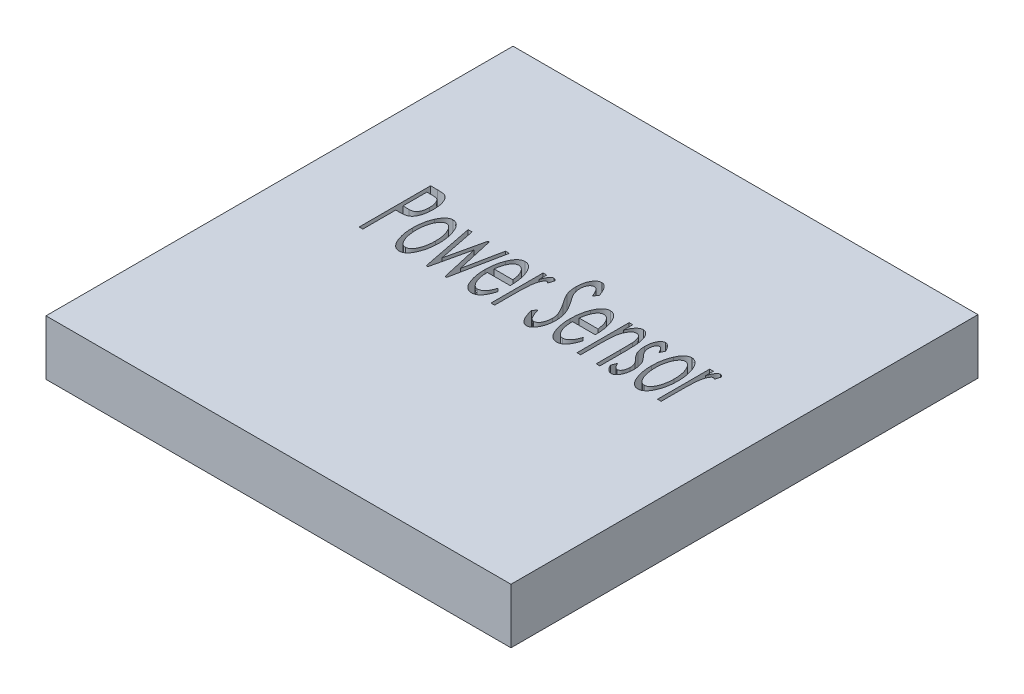
from build123d import *

# Parameters (mm, degrees)
SKETCH1_W           = 22.8
SKETCH1_H           = 22.9
BOSS_EXTRUDE1_DEPTH = 2.7
CUT_EXTRUDE1_DEPTH  = 1


with BuildPart() as part:
    # Sketch1 → Boss-Extrude1 (new body)
    with BuildSketch(Plane(origin=(0, 0, 0), x_dir=(1, 0, 0), z_dir=(0, 1, 0))):
        with Locations((-11.4, 11.45)):
            Rectangle(SKETCH1_W, SKETCH1_H)
    extrude(amount=BOSS_EXTRUDE1_DEPTH)

    # Sketch2 → Cut-Extrude1 (cut)
    # profile 1 of 11: a face of its own
    with BuildSketch(Plane(origin=(0, 2.7, 0), x_dir=(1, 0, 0), z_dir=(0, 1, 0))):
        with BuildLine():
            Line((-18.893589744, 14.95), (-18.550040064, 14.95))
            add(Edge.make_bspline(
                [(-18.550040064, 14.95), (-18.526431527, 14.949949806), (-18.481298921, 14.949853851), (-18.416547049, 14.946826514), (-18.357613941, 14.942774139), (-18.304758109, 14.937266147), (-18.257824867, 14.93060332), (-18.217206038, 14.921224082), (-18.181822555, 14.911563521), (-18.16128536, 14.901884762), (-18.151802885, 14.897415865)],
                knots=[0, 0, 0, 0, 1.400665648, 2.677662257, 3.84548299, 4.905220341, 5.830907861, 6.655166745, 7.379060902, 8, 8, 8, 8], degree=3))
            add(Edge.make_bspline(
                [(-18.151802885, 14.897415865), (-18.139460053, 14.890711185), (-18.114493334, 14.877149154), (-18.079994867, 14.850742842), (-18.047687511, 14.819202442), (-18.015883373, 14.783960042), (-17.987473005, 14.742308818), (-17.959157809, 14.697065536), (-17.933351138, 14.646313977), (-17.901136451, 14.570689323), (-17.865572943, 14.466198791), (-17.836918418, 14.327568979), (-17.819357569, 14.174313602), (-17.817588967, 14.067105438), (-17.816666667, 14.011197917)],
                knots=[0, 0, 0, 0, 0.510523556, 1.032672098, 1.573997133, 2.152394369, 2.75641807, 3.405457915, 4.093862063, 4.825255744, 6.395758809, 8.100381875, 9.966405038, 12, 12, 12, 12], degree=3))
            add(Edge.make_bspline(
                [(-17.816666667, 14.011197917), (-17.817660498, 13.955066338), (-17.819562009, 13.847668999), (-17.836102939, 13.694124339), (-17.864467958, 13.555954652), (-17.898041133, 13.451426168), (-17.930736128, 13.376627427), (-17.95636144, 13.326041555), (-17.984633679, 13.280605667), (-18.013798554, 13.238892928), (-18.047254515, 13.203640172), (-18.081397154, 13.171566811), (-18.118206152, 13.14460187), (-18.14439601, 13.130089144), (-18.157411859, 13.122876603)],
                knots=[0, 0, 0, 0, 2.028323131, 3.880819216, 5.572197309, 7.118765787, 7.837476376, 8.521238193, 9.165901164, 9.770766602, 10.3565773, 10.918517971, 11.462524529, 12, 12, 12, 12], degree=3))
            add(Edge.make_bspline(
                [(-18.157411859, 13.122876603), (-18.168085975, 13.118235109), (-18.191106628, 13.108224891), (-18.229895169, 13.096622743), (-18.274908942, 13.086917077), (-18.326253836, 13.079538892), (-18.383782964, 13.073299286), (-18.447602854, 13.068339126), (-18.517763904, 13.065599871), (-18.566630931, 13.06545838), (-18.592107372, 13.065384615)],
                knots=[0, 0, 0, 0, 0.632475031, 1.364046288, 2.196596121, 3.134759838, 4.183081226, 5.342934046, 6.614759579, 8, 8, 8, 8], degree=3))
            Line((-18.592107372, 13.065384615), (-18.714102564, 13.065384615))
            Line((-18.714102564, 13.065384615), (-18.714102564, 11.45))
            Line((-18.714102564, 11.45), (-18.893589744, 11.45))
            Line((-18.893589744, 11.45), (-18.893589744, 14.95))
        make_face()
        with BuildLine():
            Line((-18.714102564, 14.591025641), (-18.714102564, 13.424358974))
            Line((-18.714102564, 13.424358974), (-18.425941506, 13.416646635))
            add(Edge.make_bspline(
                [(-18.425941506, 13.416646635), (-18.398539785, 13.417355784), (-18.347643508, 13.418672967), (-18.277100534, 13.430581531), (-18.217624809, 13.449280483), (-18.168818641, 13.47865232), (-18.129322603, 13.517831121), (-18.094486916, 13.56549478), (-18.065759055, 13.623687678), (-18.040663013, 13.690150233), (-18.021015312, 13.763496171), (-18.005970113, 13.841945554), (-17.997765876, 13.924549203), (-17.996697755, 13.981032999), (-17.996153846, 14.009795673)],
                knots=[0, 0, 0, 0, 1.171517057, 2.175989491, 3.051930863, 3.823668683, 4.587461645, 5.417507434, 6.338794821, 7.354700361, 8.453635278, 9.583305836, 10.769371189, 12, 12, 12, 12], degree=3))
            add(Edge.make_bspline(
                [(-17.996153846, 14.009795673), (-17.996700529, 14.037857857), (-17.997778196, 14.093176443), (-18.006031699, 14.174371421), (-18.021002807, 14.251896676), (-18.040744492, 14.32475123), (-18.065674325, 14.390344668), (-18.093240996, 14.447855582), (-18.126096256, 14.494158246), (-18.163436235, 14.532045688), (-18.210093288, 14.559698959), (-18.267561258, 14.577741513), (-18.336393792, 14.589893016), (-18.386381435, 14.590628998), (-18.413321314, 14.591025641)],
                knots=[0, 0, 0, 0, 1.228640533, 2.422001712, 3.567959277, 4.682650608, 5.722243594, 6.637509838, 7.466634469, 8.197487603, 8.950360157, 9.814366158, 10.822094659, 12, 12, 12, 12], degree=3))
            Line((-18.413321314, 14.591025641), (-18.714102564, 14.591025641))
        make_face(mode=Mode.SUBTRACT)
    # profile 2 of 11: a face of its own
    with BuildSketch(Plane(origin=(0, 2.7, 0), x_dir=(1, 0, 0), z_dir=(0, 1, 0))):
        with BuildLine():
            add(Edge.make_bspline(
                [(-16.89609375, 14.052564103), (-16.872330992, 14.051499828), (-16.825066913, 14.049382989), (-16.756634199, 14.027596226), (-16.691797278, 13.993737997), (-16.629275181, 13.947678243), (-16.571360683, 13.887040065), (-16.516517801, 13.813862791), (-16.464507341, 13.72783043), (-16.434414702, 13.664440613), (-16.418629808, 13.631189904)],
                knots=[0, 0, 0, 0, 0.843577701, 1.677874383, 2.529941952, 3.44009667, 4.428447994, 5.503311921, 6.690378774, 8, 8, 8, 8], degree=3))
            add(Edge.make_bspline(
                [(-16.418629808, 13.631189904), (-16.404619617, 13.598649272), (-16.376254204, 13.532766629), (-16.341783712, 13.429700017), (-16.312313345, 13.322464577), (-16.287289102, 13.210975472), (-16.270099057, 13.094633231), (-16.255205489, 12.974333522), (-16.247992358, 12.849527953), (-16.246773081, 12.764843586), (-16.246153846, 12.721834936)],
                knots=[0, 0, 0, 0, 0.911590579, 1.845630971, 2.79426017, 3.773633235, 4.784390523, 5.820063118, 6.892875455, 8, 8, 8, 8], degree=3))
            add(Edge.make_bspline(
                [(-16.246153846, 12.721834936), (-16.246701312, 12.678588436), (-16.247779554, 12.593413901), (-16.256036605, 12.467694008), (-16.271303016, 12.346160502), (-16.290072481, 12.228435201), (-16.316829333, 12.115200316), (-16.346841974, 12.005730583), (-16.384629236, 11.900842016), (-16.426586903, 11.801177105), (-16.47244727, 11.70917736), (-16.523209409, 11.628832524), (-16.576151498, 11.559855138), (-16.633497579, 11.503657449), (-16.694015751, 11.459436135), (-16.758195027, 11.427803973), (-16.826074937, 11.408824076), (-16.872605163, 11.406368026), (-16.89609375, 11.405128205)],
                knots=[0, 0, 0, 0, 1.301298947, 2.562924903, 3.788461415, 4.986201962, 6.14793309, 7.287790237, 8.39993342, 9.49971249, 10.540722194, 11.488924044, 12.355509222, 13.151197152, 13.89676473, 14.601269901, 15.293917145, 16, 16, 16, 16], degree=3))
            add(Edge.make_bspline(
                [(-16.89609375, 11.405128205), (-16.919576348, 11.406392688), (-16.966320374, 11.408909744), (-17.034498113, 11.42765886), (-17.098889663, 11.459427395), (-17.159444074, 11.503848069), (-17.217424047, 11.559804751), (-17.271131147, 11.628617161), (-17.321821637, 11.709200257), (-17.367638038, 11.801194182), (-17.409937248, 11.900670993), (-17.446243889, 12.006030857), (-17.478057311, 12.114929737), (-17.502892757, 12.228655422), (-17.523574492, 12.34599898), (-17.537197916, 12.467770713), (-17.545903867, 12.59340098), (-17.546919978, 12.678584084), (-17.547435897, 12.721834936)],
                knots=[0, 0, 0, 0, 0.705440217, 1.4042363, 2.108100269, 2.852989273, 3.652997896, 4.523145192, 5.47048404, 6.510546275, 7.609324387, 8.718120464, 9.858867499, 11.017987859, 12.215813406, 13.439407729, 14.699885423, 16, 16, 16, 16], degree=3))
            add(Edge.make_bspline(
                [(-17.547435897, 12.721834936), (-17.546821384, 12.764611226), (-17.545608149, 12.849064474), (-17.538286837, 12.973616148), (-17.523862857, 13.093797665), (-17.505157264, 13.209409047), (-17.481321463, 13.320875114), (-17.452012247, 13.427901772), (-17.417183633, 13.530843367), (-17.388948788, 13.596538247), (-17.374959936, 13.629086538)],
                knots=[0, 0, 0, 0, 1.103600926, 2.178839769, 3.216854868, 4.224898256, 5.199312966, 6.155900535, 7.086347569, 8, 8, 8, 8], degree=3))
            add(Edge.make_bspline(
                [(-17.374959936, 13.629086538), (-17.359204859, 13.6625869), (-17.329249917, 13.726280744), (-17.27689891, 13.812728975), (-17.221790507, 13.886173275), (-17.163406817, 13.946611196), (-17.101828446, 13.994236212), (-17.036164648, 14.027515141), (-16.967348798, 14.049335652), (-16.919857769, 14.051487393), (-16.89609375, 14.052564103)],
                knots=[0, 0, 0, 0, 1.3116991, 2.493918051, 3.576000503, 4.560315464, 5.46508553, 6.321043193, 7.159867415, 8, 8, 8, 8], degree=3))
        make_face()
        with BuildLine():
            add(Edge.make_bspline(
                [(-16.896794872, 13.738461538), (-16.912797024, 13.737491904), (-16.944718932, 13.735557628), (-16.991289984, 13.720511266), (-17.035951577, 13.697151319), (-17.078585246, 13.663697672), (-17.119872534, 13.621738027), (-17.158260499, 13.569538201), (-17.195529406, 13.508802934), (-17.230644614, 13.439616387), (-17.262333571, 13.363484859), (-17.291282652, 13.283164779), (-17.31509896, 13.198811478), (-17.333788578, 13.110413091), (-17.349223903, 13.018271978), (-17.360516851, 12.922124775), (-17.366754918, 12.822180064), (-17.367545569, 12.754328672), (-17.367948718, 12.719731571)],
                knots=[0, 0, 0, 0, 0.633328474, 1.263395849, 1.922297409, 2.622747561, 3.402359392, 4.249154536, 5.185072166, 6.225072861, 7.321168891, 8.452296706, 9.607823688, 10.792618436, 12.032427099, 13.310317054, 14.628543482, 16, 16, 16, 16], degree=3))
            add(Edge.make_bspline(
                [(-17.367948718, 12.719731571), (-17.367111632, 12.675066503), (-17.365460741, 12.58697861), (-17.353272987, 12.457239937), (-17.333807103, 12.332145206), (-17.306839127, 12.213314984), (-17.273305814, 12.103073645), (-17.232658195, 12.005200527), (-17.188261075, 11.919451971), (-17.137146879, 11.848489417), (-17.082091644, 11.791280578), (-17.022972697, 11.750570298), (-16.961190509, 11.723362524), (-16.918089451, 11.720597073), (-16.896794872, 11.719230769)],
                knots=[0, 0, 0, 0, 1.343625255, 2.649881141, 3.916827948, 5.150040387, 6.313170605, 7.378672881, 8.334918638, 9.211145051, 10.001680462, 10.70963726, 11.362481287, 12, 12, 12, 12], degree=3))
            add(Edge.make_bspline(
                [(-16.896794872, 11.719230769), (-16.875498316, 11.720595017), (-16.832393256, 11.723356308), (-16.770642503, 11.750596763), (-16.711524133, 11.791073766), (-16.657138226, 11.848735664), (-16.60614675, 11.919615455), (-16.560622775, 12.004835413), (-16.521210853, 12.103278236), (-16.487575165, 12.213379215), (-16.459565054, 12.332046181), (-16.440379641, 12.457253038), (-16.42811255, 12.586975182), (-16.426472576, 12.67506535), (-16.425641026, 12.719731571)],
                knots=[0, 0, 0, 0, 0.63766136, 1.290651464, 1.99876667, 2.784553339, 3.660975812, 4.620765142, 5.683833951, 6.847224424, 8.082295646, 9.349525938, 10.656074103, 12, 12, 12, 12], degree=3))
            add(Edge.make_bspline(
                [(-16.425641026, 12.719731571), (-16.42604582, 12.754328334), (-16.426839697, 12.822179062), (-16.433054521, 12.922128552), (-16.444431635, 13.018258452), (-16.459575987, 13.110510627), (-16.479334224, 13.198740684), (-16.503219399, 13.282996151), (-16.530892297, 13.363808673), (-16.563842473, 13.439444161), (-16.598770533, 13.508772107), (-16.63589627, 13.56983163), (-16.675210908, 13.621254102), (-16.715679957, 13.663942965), (-16.758376348, 13.697116432), (-16.802991869, 13.720520885), (-16.849350344, 13.735479616), (-16.881030162, 13.737470715), (-16.896794872, 13.738461538)],
                knots=[0, 0, 0, 0, 1.372102031, 2.690948916, 3.969440344, 5.209832555, 6.397176509, 7.553247371, 8.681828641, 9.782077646, 10.822567844, 11.758925988, 12.611729478, 13.385237583, 14.08601742, 14.74522911, 15.375593043, 16, 16, 16, 16], degree=3))
        make_face(mode=Mode.SUBTRACT)
    # profile 3 of 11: a face of its own
    with BuildSketch(Plane(origin=(0, 2.7, 0), x_dir=(1, 0, 0), z_dir=(0, 1, 0))):
        Polygon((-16.111538462, 14.007692308), (-15.915925481, 14.007692308), (-15.550641026, 12.167948718), (-15.129967949, 14.007692308), (-15.068269231, 14.007692308), (-14.653205128, 12.167948718), (-14.281610577, 14.007692308), (-14.092307692, 14.007692308), (-14.608333333, 11.45), (-14.686157853, 11.45), (-15.101923077, 13.28974359), (-15.521895032, 11.45), (-15.603926282, 11.45), align=None)
    # profile 4 of 11: a face of its own
    with BuildSketch(Plane(origin=(0, 2.7, 0), x_dir=(1, 0, 0), z_dir=(0, 1, 0))):
        with BuildLine():
            Line((-12.885677083, 12.257692308), (-12.746153846, 12.111157853))
            add(Edge.make_bspline(
                [(-12.746153846, 12.111157853), (-12.757466451, 12.072014137), (-12.779102911, 11.997147964), (-12.816096929, 11.891303538), (-12.856396617, 11.797561492), (-12.89952084, 11.715426938), (-12.944389722, 11.643409243), (-12.993208451, 11.581733517), (-13.043526298, 11.527494985), (-13.097672292, 11.483006277), (-13.154968138, 11.448079326), (-13.215873338, 11.422871347), (-13.280620624, 11.407918054), (-13.325203871, 11.406064277), (-13.347716346, 11.405128205)],
                knots=[0, 0, 0, 0, 1.469774626, 2.811087318, 4.042166936, 5.147176912, 6.155303339, 7.098135502, 7.980804388, 8.819619538, 9.617788822, 10.392823073, 11.188450055, 12, 12, 12, 12], degree=3))
            add(Edge.make_bspline(
                [(-13.347716346, 11.405128205), (-13.372844196, 11.406303386), (-13.422437359, 11.408622762), (-13.494306173, 11.428263056), (-13.561505099, 11.460662749), (-13.624463817, 11.505528976), (-13.682967931, 11.563269306), (-13.736998679, 11.633519024), (-13.786724722, 11.716220712), (-13.831137191, 11.810076495), (-13.87125385, 11.911396059), (-13.906079051, 12.017581718), (-13.936705744, 12.12688715), (-13.959990321, 12.239935557), (-13.978927732, 12.355717558), (-13.993382223, 12.474727222), (-14.000727548, 12.597174143), (-14.001947672, 12.679993169), (-14.002564103, 12.721834936)],
                knots=[0, 0, 0, 0, 0.751038303, 1.482274219, 2.211198371, 2.973871351, 3.785035177, 4.662261782, 5.619491828, 6.667478129, 7.76628157, 8.878823215, 10.010633725, 11.161560532, 12.33097756, 13.521271466, 14.747698584, 16, 16, 16, 16], degree=3))
            add(Edge.make_bspline(
                [(-14.002564103, 12.721834936), (-14.002214191, 12.761107742), (-14.001522121, 12.838783369), (-13.994392156, 12.953660215), (-13.982350049, 13.065434868), (-13.966300245, 13.173978283), (-13.946204961, 13.279369385), (-13.920782959, 13.381366101), (-13.890903658, 13.480164118), (-13.867109399, 13.544130582), (-13.855328526, 13.575801282)],
                knots=[0, 0, 0, 0, 1.081354805, 2.138755058, 3.167849101, 4.176290871, 5.159507986, 6.121001866, 7.069681469, 8, 8, 8, 8], degree=3))
            add(Edge.make_bspline(
                [(-13.855328526, 13.575801282), (-13.839823901, 13.613236272), (-13.810190735, 13.684783779), (-13.758187066, 13.782579372), (-13.70074214, 13.864760433), (-13.640896376, 13.933460821), (-13.575208042, 13.986253124), (-13.506177755, 14.025300583), (-13.431818877, 14.047882012), (-13.381047176, 14.0509939), (-13.355428686, 14.052564103)],
                knots=[0, 0, 0, 0, 1.322197472, 2.527045748, 3.606318956, 4.589521203, 5.490186208, 6.34374623, 7.164284008, 8, 8, 8, 8], degree=3))
            add(Edge.make_bspline(
                [(-13.355428686, 14.052564103), (-13.329056335, 14.051188214), (-13.276597416, 14.048451348), (-13.200622838, 14.02280159), (-13.128907365, 13.982906907), (-13.061463856, 13.927090716), (-12.999653765, 13.854603575), (-12.94190637, 13.766886805), (-12.886825884, 13.664324731), (-12.856633127, 13.588767662), (-12.840805288, 13.549158654)],
                knots=[0, 0, 0, 0, 0.823440567, 1.637957963, 2.48296191, 3.382350809, 4.36252078, 5.454315555, 6.665485104, 8, 8, 8, 8], degree=3))
            add(Edge.make_bspline(
                [(-12.840805288, 13.549158654), (-12.82969918, 13.518661622), (-12.807099922, 13.456604753), (-12.779207247, 13.359146025), (-12.755571223, 13.256370141), (-12.73600791, 13.148038051), (-12.720379006, 13.034383), (-12.710508797, 12.91500247), (-12.703038308, 12.790168659), (-12.701875727, 12.705019924), (-12.701282051, 12.661538462)],
                knots=[0, 0, 0, 0, 0.862103675, 1.754251248, 2.691108883, 3.663011642, 4.678144778, 5.737819903, 6.844810799, 8, 8, 8, 8], degree=3))
            Line((-12.701282051, 12.661538462), (-13.823076923, 12.661538462))
            add(Edge.make_bspline(
                [(-13.823076923, 12.661538462), (-13.822566861, 12.627862474), (-13.821566627, 12.561823783), (-13.812911888, 12.465335678), (-13.803437967, 12.373173644), (-13.787381806, 12.28628213), (-13.769107696, 12.203587695), (-13.74467879, 12.126225581), (-13.718572845, 12.052444812), (-13.68717632, 11.984643881), (-13.653099922, 11.922900253), (-13.616802153, 11.868876164), (-13.578975153, 11.822580833), (-13.538787866, 11.784897917), (-13.49635301, 11.755467565), (-13.451430052, 11.735032509), (-13.404807905, 11.721615618), (-13.372811836, 11.720025151), (-13.356830929, 11.719230769)],
                knots=[0, 0, 0, 0, 1.414313561, 2.773472163, 4.06801243, 5.30443612, 6.48331242, 7.623069609, 8.710148246, 9.768882371, 10.757758178, 11.669971891, 12.499622512, 13.26377558, 13.977242447, 14.658150177, 15.329793424, 16, 16, 16, 16], degree=3))
            add(Edge.make_bspline(
                [(-13.356830929, 11.719230769), (-13.341106323, 11.719860067), (-13.309487336, 11.721125458), (-13.262616895, 11.732998761), (-13.216759534, 11.752251777), (-13.17201888, 11.778503863), (-13.12867193, 11.810131543), (-13.089672145, 11.8487827), (-13.05279201, 11.890806356), (-13.018665968, 11.939527349), (-12.986393408, 11.998980089), (-12.953356427, 12.071426169), (-12.918864564, 12.15923632), (-12.897293675, 12.223229823), (-12.885677083, 12.257692308)],
                knots=[0, 0, 0, 0, 0.738465075, 1.484903234, 2.258522336, 3.071061432, 3.91960142, 4.774665461, 5.647350008, 6.546892649, 7.56535417, 8.824326256, 10.289801275, 12, 12, 12, 12], degree=3))
        make_face()
        with BuildLine():
            add(Edge.make_bspline(
                [(-12.880769231, 12.975641026), (-12.886521772, 13.017055411), (-12.8974456, 13.095699549), (-12.917970639, 13.206841418), (-12.94303073, 13.304541548), (-12.971902269, 13.39020315), (-13.005143709, 13.465582529), (-13.042878428, 13.532927547), (-13.086587786, 13.591973235), (-13.134080308, 13.642956371), (-13.183706448, 13.685994601), (-13.237183481, 13.715326989), (-13.29136555, 13.735556789), (-13.328615141, 13.737501108), (-13.347015224, 13.738461538)],
                knots=[0, 0, 0, 0, 1.557983534, 2.958543775, 4.20899479, 5.313354295, 6.323151934, 7.274795459, 8.184011725, 9.052834006, 9.869040623, 10.617635379, 11.317156976, 12, 12, 12, 12], degree=3))
            add(Edge.make_bspline(
                [(-13.347015224, 13.738461538), (-13.362037507, 13.73783301), (-13.392043746, 13.736577557), (-13.43606161, 13.724952579), (-13.477954537, 13.705180525), (-13.51923593, 13.679414874), (-13.557274345, 13.644383671), (-13.594438538, 13.602889475), (-13.629973928, 13.554053956), (-13.650944099, 13.517588377), (-13.66181891, 13.498677885)],
                knots=[0, 0, 0, 0, 0.865497469, 1.728786899, 2.60358039, 3.531120603, 4.52424669, 5.574483609, 6.742164244, 8, 8, 8, 8], degree=3))
            add(Edge.make_bspline(
                [(-13.66181891, 13.498677885), (-13.669755221, 13.483358677), (-13.686320552, 13.451383148), (-13.707576576, 13.399397772), (-13.728043096, 13.342355105), (-13.746977447, 13.279636826), (-13.76415078, 13.211254019), (-13.780483667, 13.13767899), (-13.794224424, 13.058507301), (-13.802605878, 13.003933845), (-13.806951122, 12.975641026)],
                knots=[0, 0, 0, 0, 0.758823364, 1.583879516, 2.4686208, 3.425043348, 4.465103222, 5.570473885, 6.74044733, 8, 8, 8, 8], degree=3))
            Line((-13.806951122, 12.975641026), (-12.880769231, 12.975641026))
        make_face(mode=Mode.SUBTRACT)
    # profile 5 of 11: a face of its own
    with BuildSketch(Plane(origin=(0, 2.7, 0), x_dir=(1, 0, 0), z_dir=(0, 1, 0))):
        with BuildLine():
            Line((-12.432051282, 14.007692308), (-12.252564103, 14.007692308))
            Line((-12.252564103, 14.007692308), (-12.252564103, 13.631189904))
            add(Edge.make_bspline(
                [(-12.252564103, 13.631189904), (-12.241144288, 13.665960521), (-12.219752566, 13.731093223), (-12.182578832, 13.819283443), (-12.145739446, 13.892720514), (-12.107435837, 13.951448507), (-12.066764919, 13.995461687), (-12.026862741, 14.028756367), (-11.984032575, 14.048446353), (-11.954757543, 14.051219615), (-11.940564904, 14.052564103)],
                knots=[0, 0, 0, 0, 1.585633559, 2.970226224, 4.143554047, 5.143681873, 5.996763239, 6.732369705, 7.385448357, 8, 8, 8, 8], degree=3))
            add(Edge.make_bspline(
                [(-11.940564904, 14.052564103), (-11.929645685, 14.051302019), (-11.906278837, 14.048601191), (-11.871870602, 14.0305417), (-11.836571096, 14.002734566), (-11.815347114, 13.978212189), (-11.803846154, 13.964923878)],
                knots=[0, 0, 0, 0, 0.783612691, 1.676910978, 2.741152627, 4, 4, 4, 4], degree=3))
            Line((-11.803846154, 13.964923878), (-11.890084135, 13.692888622))
            add(Edge.make_bspline(
                [(-11.890084135, 13.692888622), (-11.897694503, 13.699561453), (-11.911744356, 13.711880475), (-11.932418117, 13.726947977), (-11.951958922, 13.736481697), (-11.964791416, 13.737836395), (-11.970713141, 13.738461538)],
                knots=[0, 0, 0, 0, 1.284577118, 2.371517395, 3.248515015, 4, 4, 4, 4], degree=3))
            add(Edge.make_bspline(
                [(-11.970713141, 13.738461538), (-11.98372168, 13.736664434), (-12.011603193, 13.732812657), (-12.049219989, 13.703201038), (-12.085388033, 13.660210326), (-12.120991247, 13.600326708), (-12.153633978, 13.523079915), (-12.181514521, 13.427418153), (-12.206869043, 13.313903742), (-12.218374487, 13.231427905), (-12.224519231, 13.187379808)],
                knots=[0, 0, 0, 0, 0.485134988, 1.039801416, 1.736123207, 2.59795597, 3.638971913, 4.876325678, 6.331730643, 8, 8, 8, 8], degree=3))
            add(Edge.make_bspline(
                [(-12.224519231, 13.187379808), (-12.226741671, 13.16705834), (-12.231690536, 13.121807084), (-12.236943258, 13.046731755), (-12.241767272, 12.957678259), (-12.246070662, 12.854845285), (-12.248545094, 12.738201876), (-12.250679293, 12.607791962), (-12.252047641, 12.463357268), (-12.252386718, 12.362393427), (-12.252564103, 12.309575321)],
                knots=[0, 0, 0, 0, 0.558358783, 1.243337199, 2.055316671, 2.994523906, 4.05455052, 5.24210095, 6.557235908, 8, 8, 8, 8], degree=3))
            Line((-12.252564103, 12.309575321), (-12.252564103, 11.45))
            Line((-12.252564103, 11.45), (-12.432051282, 11.45))
            Line((-12.432051282, 11.45), (-12.432051282, 14.007692308))
        make_face()
    # profile 6 of 11: a face of its own
    with BuildSketch(Plane(origin=(0, 2.7, 0), x_dir=(1, 0, 0), z_dir=(0, 1, 0))):
        with BuildLine():
            Line((-11.130769231, 12.125180288), (-10.982832532, 12.302564103))
            add(Edge.make_bspline(
                [(-10.982832532, 12.302564103), (-10.969463147, 12.256860077), (-10.944325272, 12.170924778), (-10.902671083, 12.051891944), (-10.859069871, 11.950902297), (-10.812945104, 11.868519458), (-10.766461431, 11.802754465), (-10.717070395, 11.755871993), (-10.665037553, 11.725017331), (-10.62817547, 11.721103533), (-10.610536859, 11.719230769)],
                knots=[0, 0, 0, 0, 1.568352951, 2.948906118, 4.151844576, 5.185954743, 6.055883752, 6.791251877, 7.421610583, 8, 8, 8, 8], degree=3))
            add(Edge.make_bspline(
                [(-10.610536859, 11.719230769), (-10.595426477, 11.72008844), (-10.565096742, 11.721809965), (-10.521197461, 11.738963881), (-10.47848984, 11.764211089), (-10.439138392, 11.801033191), (-10.400969045, 11.844436771), (-10.369399211, 11.897244977), (-10.340871775, 11.955691421), (-10.318383482, 12.020800098), (-10.300241542, 12.090183788), (-10.287962978, 12.162471691), (-10.279872181, 12.236709927), (-10.278766818, 12.286883903), (-10.278205128, 12.312379808)],
                knots=[0, 0, 0, 0, 0.729438802, 1.464138049, 2.256908216, 3.123479967, 4.063589739, 5.05078871, 6.094679008, 7.21272966, 8.383389924, 9.568056862, 10.764208154, 12, 12, 12, 12], degree=3))
            add(Edge.make_bspline(
                [(-10.278205128, 12.312379808), (-10.279150616, 12.341389367), (-10.281048314, 12.399614802), (-10.292163468, 12.486321309), (-10.312017649, 12.572183808), (-10.331002026, 12.627797963), (-10.340604968, 12.655929487)],
                knots=[0, 0, 0, 0, 0.992167746, 1.991391794, 2.983977898, 4, 4, 4, 4], degree=3))
            add(Edge.make_bspline(
                [(-10.340604968, 12.655929487), (-10.348330603, 12.675887476), (-10.364325507, 12.717207847), (-10.393506464, 12.779394028), (-10.426640405, 12.844767304), (-10.463519283, 12.913206085), (-10.505277326, 12.984443277), (-10.551542322, 13.05841603), (-10.601910846, 13.135805024), (-10.638187328, 13.187488993), (-10.656810897, 13.214022436)],
                knots=[0, 0, 0, 0, 0.798535385, 1.653261741, 2.562172331, 3.533989624, 4.554273534, 5.643447265, 6.790196275, 8, 8, 8, 8], degree=3))
            add(Edge.make_bspline(
                [(-10.656810897, 13.214022436), (-10.675105635, 13.240386016), (-10.710399363, 13.291245945), (-10.759981665, 13.364936136), (-10.803594095, 13.433406302), (-10.842151668, 13.495812412), (-10.875972472, 13.552033661), (-10.903508683, 13.603172287), (-10.926137766, 13.64813948), (-10.938103684, 13.676931809), (-10.943569712, 13.690084135)],
                knots=[0, 0, 0, 0, 1.383356619, 2.668735322, 3.828583161, 4.88265847, 5.831258837, 6.656238627, 7.386170294, 8, 8, 8, 8], degree=3))
            add(Edge.make_bspline(
                [(-10.943569712, 13.690084135), (-10.958769256, 13.731633618), (-10.989391122, 13.815341571), (-11.018306303, 13.947065), (-11.037482605, 14.083313222), (-11.039831857, 14.17589221), (-11.041025641, 14.222936699)],
                knots=[0, 0, 0, 0, 0.973614624, 1.961499385, 2.964125435, 4, 4, 4, 4], degree=3))
            add(Edge.make_bspline(
                [(-11.041025641, 14.222936699), (-11.040434172, 14.259892315), (-11.039270838, 14.332578707), (-11.027710885, 14.438963861), (-11.009542213, 14.540429441), (-10.984897491, 14.636112995), (-10.952521056, 14.724165556), (-10.91563569, 14.803930494), (-10.870489721, 14.872634161), (-10.821525713, 14.932133877), (-10.766712336, 14.978720181), (-10.710328061, 15.014923855), (-10.649725674, 15.035254134), (-10.608566895, 15.038252615), (-10.588100962, 15.03974359)],
                knots=[0, 0, 0, 0, 1.302243905, 2.561326771, 3.766769307, 4.933679616, 6.038667755, 7.070383732, 8.023209494, 8.929269029, 9.776334562, 10.549164443, 11.278581519, 12, 12, 12, 12], degree=3))
            add(Edge.make_bspline(
                [(-10.588100962, 15.03974359), (-10.566391523, 15.038257225), (-10.522140205, 15.035227501), (-10.45773083, 15.009641831), (-10.396799842, 14.96820897), (-10.34884237, 14.922355599), (-10.311750413, 14.876653344), (-10.282190773, 14.835002068), (-10.252326431, 14.786722308), (-10.221980167, 14.731807164), (-10.192432381, 14.669772207), (-10.160400518, 14.601940782), (-10.129150892, 14.526966428), (-10.109094245, 14.474459899), (-10.098717949, 14.447295673)],
                knots=[0, 0, 0, 0, 0.958957112, 1.954685084, 3.022514469, 4.208450865, 4.877671184, 5.627223207, 6.468676016, 7.390499487, 8.404192042, 9.510887503, 10.712258951, 12, 12, 12, 12], degree=3))
            Line((-10.098717949, 14.447295673), (-10.240344551, 14.232051282))
            add(Edge.make_bspline(
                [(-10.240344551, 14.232051282), (-10.249108365, 14.254067309), (-10.265885162, 14.296213163), (-10.291859637, 14.356064429), (-10.317276396, 14.409520527), (-10.339996458, 14.458020164), (-10.36340955, 14.499739015), (-10.384895677, 14.536526684), (-10.405678695, 14.567276135), (-10.431427376, 14.599545373), (-10.463602345, 14.631876677), (-10.505466923, 14.659915757), (-10.549634924, 14.677385156), (-10.580007268, 14.679645237), (-10.595112179, 14.680769231)],
                knots=[0, 0, 0, 0, 1.413636045, 2.706160378, 3.89127397, 4.945110297, 5.899841616, 6.743910795, 7.486406877, 8.11133637, 9.205712615, 10.19179431, 11.100734943, 12, 12, 12, 12], degree=3))
            add(Edge.make_bspline(
                [(-10.595112179, 14.680769231), (-10.614125089, 14.679477374), (-10.651986926, 14.676904802), (-10.704417173, 14.649554485), (-10.75107374, 14.608273418), (-10.789846254, 14.551681716), (-10.821729406, 14.484647306), (-10.844678544, 14.408770647), (-10.858817286, 14.325591194), (-10.860610881, 14.267633705), (-10.861538462, 14.237660256)],
                knots=[0, 0, 0, 0, 0.79579918, 1.584734725, 2.436702041, 3.404729197, 4.453787608, 5.557257582, 6.73670489, 8, 8, 8, 8], degree=3))
            add(Edge.make_bspline(
                [(-10.861538462, 14.237660256), (-10.860213428, 14.200449119), (-10.857580743, 14.126514957), (-10.842694956, 14.03441322), (-10.82167743, 13.961648416), (-10.802271995, 13.904481035), (-10.776580435, 13.845489275), (-10.756791496, 13.805910949), (-10.746554487, 13.785436699)],
                knots=[0, 0, 0, 0, 1.420859498, 2.8230811, 3.546143798, 4.310780757, 5.126150569, 6, 6, 6, 6], degree=3))
            add(Edge.make_bspline(
                [(-10.746554487, 13.785436699), (-10.742898809, 13.778610076), (-10.73428246, 13.762519886), (-10.717052548, 13.736233864), (-10.69511254, 13.70280299), (-10.667929126, 13.66280675), (-10.636576148, 13.615378892), (-10.598974288, 13.562322358), (-10.557085422, 13.501738591), (-10.526924379, 13.459376793), (-10.510977564, 13.436979167)],
                knots=[0, 0, 0, 0, 0.441516879, 1.040644968, 1.791184597, 2.722884995, 3.798775003, 5.033909202, 6.431761751, 8, 8, 8, 8], degree=3))
            add(Edge.make_bspline(
                [(-10.510977564, 13.436979167), (-10.491887532, 13.409274691), (-10.454662262, 13.355251388), (-10.402733797, 13.274225937), (-10.354848599, 13.195921056), (-10.312168082, 13.119613164), (-10.274184705, 13.045655173), (-10.240246454, 12.974306033), (-10.211570878, 12.904682537), (-10.178967427, 12.815738983), (-10.147258837, 12.705497735), (-10.118482669, 12.573284194), (-10.102240169, 12.440391998), (-10.099889493, 12.351683196), (-10.098717949, 12.307471955)],
                knots=[0, 0, 0, 0, 0.99024893, 1.930970196, 2.832309687, 3.691557991, 4.503781416, 5.279255253, 6.016373765, 6.719283559, 8.066752574, 9.388962779, 10.698695122, 12, 12, 12, 12], degree=3))
            add(Edge.make_bspline(
                [(-10.098717949, 12.307471955), (-10.099042507, 12.276139549), (-10.099682787, 12.214327871), (-10.107120151, 12.123326622), (-10.117952897, 12.035238153), (-10.134399747, 11.950360008), (-10.154303719, 11.868233239), (-10.179807264, 11.789674873), (-10.209196165, 11.71411781), (-10.243161619, 11.643007824), (-10.279768613, 11.577379429), (-10.318816772, 11.519593073), (-10.360165596, 11.47058025), (-10.404003445, 11.431033195), (-10.449395766, 11.399176687), (-10.497256154, 11.37669659), (-10.547324542, 11.362452123), (-10.581464349, 11.360990698), (-10.598617788, 11.36025641)],
                knots=[0, 0, 0, 0, 1.29116139, 2.547166425, 3.761130522, 4.947608578, 6.108789059, 7.242063163, 8.349369122, 9.448136022, 10.487665158, 11.444210095, 12.318757237, 13.123569585, 13.871734928, 14.595694415, 15.29441103, 16, 16, 16, 16], degree=3))
            add(Edge.make_bspline(
                [(-10.598617788, 11.36025641), (-10.611994299, 11.360757626), (-10.638549199, 11.361752634), (-10.677523258, 11.370963512), (-10.715929913, 11.383754398), (-10.752440713, 11.40448735), (-10.789158026, 11.428582272), (-10.824250828, 11.459417214), (-10.858701902, 11.49513307), (-10.891737236, 11.537112513), (-10.924337796, 11.585222331), (-10.955563702, 11.640745559), (-10.986334946, 11.703617788), (-11.017277284, 11.773352307), (-11.046314558, 11.851118505), (-11.07601063, 11.935522878), (-11.103740209, 12.027900746), (-11.121539427, 12.091961509), (-11.130769231, 12.125180288)],
                knots=[0, 0, 0, 0, 0.645470283, 1.281380466, 1.928035824, 2.595184914, 3.303254066, 4.048207906, 4.847133812, 5.699234258, 6.626628955, 7.653657135, 8.775177175, 10.009316141, 11.339399728, 12.786247291, 14.333504987, 16, 16, 16, 16], degree=3))
        make_face()
    # profile 7 of 11: a face of its own
    with BuildSketch(Plane(origin=(0, 2.7, 0), x_dir=(1, 0, 0), z_dir=(0, 1, 0))):
        with BuildLine():
            Line((-8.71260016, 12.257692308), (-8.573076923, 12.111157853))
            add(Edge.make_bspline(
                [(-8.573076923, 12.111157853), (-8.584389528, 12.072014137), (-8.606025987, 11.997147964), (-8.643020006, 11.891303538), (-8.683319694, 11.797561492), (-8.726443917, 11.715426938), (-8.771312799, 11.643409243), (-8.820131528, 11.581733517), (-8.870449375, 11.527494985), (-8.924595369, 11.483006277), (-8.981891215, 11.448079326), (-9.042796415, 11.422871347), (-9.107543701, 11.407918054), (-9.152126947, 11.406064277), (-9.174639423, 11.405128205)],
                knots=[0, 0, 0, 0, 1.469774626, 2.811087318, 4.042166936, 5.147176912, 6.155303339, 7.098135502, 7.980804388, 8.819619538, 9.617788822, 10.392823073, 11.188450055, 12, 12, 12, 12], degree=3))
            add(Edge.make_bspline(
                [(-9.174639423, 11.405128205), (-9.199767273, 11.406303386), (-9.249360436, 11.408622762), (-9.32122925, 11.428263056), (-9.388428175, 11.460662749), (-9.451386894, 11.505528976), (-9.509891008, 11.563269306), (-9.563921756, 11.633519024), (-9.613647799, 11.716220712), (-9.658060268, 11.810076495), (-9.698176927, 11.911396059), (-9.733002128, 12.017581718), (-9.76362882, 12.12688715), (-9.786913398, 12.239935557), (-9.805850809, 12.355717558), (-9.8203053, 12.474727222), (-9.827650625, 12.597174143), (-9.828870749, 12.679993169), (-9.829487179, 12.721834936)],
                knots=[0, 0, 0, 0, 0.751038303, 1.482274219, 2.211198371, 2.973871351, 3.785035177, 4.662261782, 5.619491828, 6.667478129, 7.76628157, 8.878823215, 10.010633725, 11.161560532, 12.33097756, 13.521271466, 14.747698584, 16, 16, 16, 16], degree=3))
            add(Edge.make_bspline(
                [(-9.829487179, 12.721834936), (-9.829137268, 12.761107742), (-9.828445198, 12.838783369), (-9.821315233, 12.953660215), (-9.809273126, 13.065434868), (-9.793223322, 13.173978283), (-9.773128038, 13.279369385), (-9.747706036, 13.381366101), (-9.717826735, 13.480164118), (-9.694032476, 13.544130582), (-9.682251603, 13.575801282)],
                knots=[0, 0, 0, 0, 1.081354805, 2.138755058, 3.167849101, 4.176290871, 5.159507986, 6.121001866, 7.069681469, 8, 8, 8, 8], degree=3))
            add(Edge.make_bspline(
                [(-9.682251603, 13.575801282), (-9.666746978, 13.613236272), (-9.637113812, 13.684783779), (-9.585110143, 13.782579372), (-9.527665217, 13.864760433), (-9.467819453, 13.933460821), (-9.402131119, 13.986253124), (-9.333100832, 14.025300583), (-9.258741953, 14.047882012), (-9.207970253, 14.0509939), (-9.182351763, 14.052564103)],
                knots=[0, 0, 0, 0, 1.322197472, 2.527045748, 3.606318956, 4.589521203, 5.490186208, 6.34374623, 7.164284008, 8, 8, 8, 8], degree=3))
            add(Edge.make_bspline(
                [(-9.182351763, 14.052564103), (-9.155979412, 14.051188214), (-9.103520493, 14.048451348), (-9.027545914, 14.02280159), (-8.955830442, 13.982906907), (-8.888386933, 13.927090716), (-8.826576842, 13.854603575), (-8.768829447, 13.766886805), (-8.713748961, 13.664324731), (-8.683556204, 13.588767662), (-8.667728365, 13.549158654)],
                knots=[0, 0, 0, 0, 0.823440567, 1.637957963, 2.48296191, 3.382350809, 4.36252078, 5.454315555, 6.665485104, 8, 8, 8, 8], degree=3))
            add(Edge.make_bspline(
                [(-8.667728365, 13.549158654), (-8.656622257, 13.518661622), (-8.634022999, 13.456604753), (-8.606130324, 13.359146025), (-8.5824943, 13.256370141), (-8.562930987, 13.148038051), (-8.547302083, 13.034383), (-8.537431874, 12.91500247), (-8.529961385, 12.790168659), (-8.528798804, 12.705019924), (-8.528205128, 12.661538462)],
                knots=[0, 0, 0, 0, 0.862103675, 1.754251248, 2.691108883, 3.663011642, 4.678144778, 5.737819903, 6.844810799, 8, 8, 8, 8], degree=3))
            Line((-8.528205128, 12.661538462), (-9.65, 12.661538462))
            add(Edge.make_bspline(
                [(-9.65, 12.661538462), (-9.649489937, 12.627862474), (-9.648489704, 12.561823783), (-9.639834964, 12.465335678), (-9.630361044, 12.373173644), (-9.614304883, 12.28628213), (-9.596030773, 12.203587695), (-9.571601867, 12.126225581), (-9.545495922, 12.052444812), (-9.514099397, 11.984643881), (-9.480022999, 11.922900253), (-9.44372523, 11.868876164), (-9.40589823, 11.822580833), (-9.365710942, 11.784897917), (-9.323276087, 11.755467565), (-9.278353129, 11.735032509), (-9.231730982, 11.721615618), (-9.199734913, 11.720025151), (-9.183754006, 11.719230769)],
                knots=[0, 0, 0, 0, 1.414313561, 2.773472163, 4.06801243, 5.30443612, 6.48331242, 7.623069609, 8.710148246, 9.768882371, 10.757758178, 11.669971891, 12.499622512, 13.26377558, 13.977242447, 14.658150177, 15.329793424, 16, 16, 16, 16], degree=3))
            add(Edge.make_bspline(
                [(-9.183754006, 11.719230769), (-9.1680294, 11.719860067), (-9.136410412, 11.721125458), (-9.089539972, 11.732998761), (-9.043682611, 11.752251777), (-8.998941957, 11.778503863), (-8.955595007, 11.810131543), (-8.916595222, 11.8487827), (-8.879715087, 11.890806356), (-8.845589045, 11.939527349), (-8.813316485, 11.998980089), (-8.780279504, 12.071426169), (-8.745787641, 12.15923632), (-8.724216752, 12.223229823), (-8.71260016, 12.257692308)],
                knots=[0, 0, 0, 0, 0.738465075, 1.484903234, 2.258522336, 3.071061432, 3.91960142, 4.774665461, 5.647350008, 6.546892649, 7.56535417, 8.824326256, 10.289801275, 12, 12, 12, 12], degree=3))
        make_face()
        with BuildLine():
            add(Edge.make_bspline(
                [(-8.707692308, 12.975641026), (-8.713444849, 13.017055411), (-8.724368677, 13.095699549), (-8.744893716, 13.206841418), (-8.769953806, 13.304541548), (-8.798825345, 13.39020315), (-8.832066786, 13.465582529), (-8.869801505, 13.532927547), (-8.913510863, 13.591973235), (-8.961003385, 13.642956371), (-9.010629525, 13.685994601), (-9.064106558, 13.715326989), (-9.118288627, 13.735556789), (-9.155538218, 13.737501108), (-9.173938301, 13.738461538)],
                knots=[0, 0, 0, 0, 1.557983534, 2.958543775, 4.20899479, 5.313354295, 6.323151934, 7.274795459, 8.184011725, 9.052834006, 9.869040623, 10.617635379, 11.317156976, 12, 12, 12, 12], degree=3))
            add(Edge.make_bspline(
                [(-9.173938301, 13.738461538), (-9.188960583, 13.73783301), (-9.218966823, 13.736577557), (-9.262984686, 13.724952579), (-9.304877614, 13.705180525), (-9.346159007, 13.679414874), (-9.384197422, 13.644383671), (-9.421361615, 13.602889475), (-9.456897004, 13.554053956), (-9.477867176, 13.517588377), (-9.488741987, 13.498677885)],
                knots=[0, 0, 0, 0, 0.865497469, 1.728786899, 2.60358039, 3.531120603, 4.52424669, 5.574483609, 6.742164244, 8, 8, 8, 8], degree=3))
            add(Edge.make_bspline(
                [(-9.488741987, 13.498677885), (-9.496678298, 13.483358677), (-9.513243629, 13.451383148), (-9.534499653, 13.399397772), (-9.554966173, 13.342355105), (-9.573900524, 13.279636826), (-9.591073857, 13.211254019), (-9.607406744, 13.13767899), (-9.621147501, 13.058507301), (-9.629528955, 13.003933845), (-9.633874199, 12.975641026)],
                knots=[0, 0, 0, 0, 0.758823364, 1.583879516, 2.4686208, 3.425043348, 4.465103222, 5.570473885, 6.74044733, 8, 8, 8, 8], degree=3))
            Line((-9.633874199, 12.975641026), (-8.707692308, 12.975641026))
        make_face(mode=Mode.SUBTRACT)
    # profile 8 of 11: a face of its own
    with BuildSketch(Plane(origin=(0, 2.7, 0), x_dir=(1, 0, 0), z_dir=(0, 1, 0))):
        with BuildLine():
            Line((-8.214102564, 14.007692308), (-8.034615385, 14.007692308))
            Line((-8.034615385, 14.007692308), (-8.034615385, 13.546354167))
            add(Edge.make_bspline(
                [(-8.034615385, 13.546354167), (-8.018373116, 13.587732372), (-7.987729924, 13.665797842), (-7.935726888, 13.772157077), (-7.880320014, 13.860398275), (-7.822043198, 13.930963536), (-7.760641977, 13.985331735), (-7.69635109, 14.023894538), (-7.628681436, 14.047977273), (-7.582343782, 14.051038676), (-7.559254808, 14.052564103)],
                knots=[0, 0, 0, 0, 1.44494997, 2.726089628, 3.843303477, 4.824976299, 5.692059493, 6.496121309, 7.250652256, 8, 8, 8, 8], degree=3))
            add(Edge.make_bspline(
                [(-7.559254808, 14.052564103), (-7.536103508, 14.050739976), (-7.489424937, 14.047062098), (-7.421985891, 14.018506775), (-7.360434562, 13.971105843), (-7.303878149, 13.907158877), (-7.253560216, 13.828180183), (-7.208230315, 13.736781049), (-7.172720783, 13.631792662), (-7.14788044, 13.536025956), (-7.131093881, 13.450376137), (-7.121202851, 13.376340028), (-7.111753056, 13.293866558), (-7.105212513, 13.202859213), (-7.099554373, 13.10329007), (-7.095500894, 12.995063509), (-7.092479593, 12.87843581), (-7.092366193, 12.797791985), (-7.092307692, 12.756189904)],
                knots=[0, 0, 0, 0, 0.743568692, 1.499212768, 2.316054105, 3.226782637, 4.232337739, 5.32220957, 6.502109852, 7.791896087, 8.504381504, 9.30960864, 10.195045147, 11.17573483, 12.245488089, 13.404685061, 14.661143592, 16, 16, 16, 16], degree=3))
            Line((-7.092307692, 12.756189904), (-7.092307692, 11.45))
            Line((-7.092307692, 11.45), (-7.271794872, 11.45))
            Line((-7.271794872, 11.45), (-7.271794872, 12.653125))
            add(Edge.make_bspline(
                [(-7.271794872, 12.653125), (-7.271727221, 12.687947594), (-7.271597819, 12.754555427), (-7.272475593, 12.84990706), (-7.273232424, 12.936377234), (-7.273603081, 13.013743468), (-7.275308155, 13.08197732), (-7.276379123, 13.141123289), (-7.278577877, 13.191130436), (-7.280190009, 13.221502127), (-7.280909455, 13.23505609)],
                knots=[0, 0, 0, 0, 1.435804352, 2.746372611, 3.931673093, 5.00134256, 5.936259494, 6.745935645, 7.44034915, 8, 8, 8, 8], degree=3))
            add(Edge.make_bspline(
                [(-7.280909455, 13.23505609), (-7.283882095, 13.274408396), (-7.28947333, 13.348426112), (-7.308795462, 13.451267356), (-7.33621348, 13.538916824), (-7.372661029, 13.610815407), (-7.416098169, 13.66792705), (-7.467331275, 13.70871078), (-7.525467297, 13.734515819), (-7.566940876, 13.737132706), (-7.588000801, 13.738461538)],
                knots=[0, 0, 0, 0, 1.455119256, 2.736932434, 3.852160231, 4.831667357, 5.697564978, 6.477261495, 7.226766556, 8, 8, 8, 8], degree=3))
            add(Edge.make_bspline(
                [(-7.588000801, 13.738461538), (-7.600445197, 13.737986573), (-7.625212254, 13.737041287), (-7.661725604, 13.72732145), (-7.696779121, 13.711682778), (-7.731310884, 13.690317695), (-7.763562634, 13.661694686), (-7.796687867, 13.628775337), (-7.826874428, 13.588239953), (-7.867758735, 13.526763867), (-7.912949695, 13.439422277), (-7.955943975, 13.323671251), (-7.990044825, 13.196665801), (-8.003705818, 13.107390186), (-8.010777244, 13.061177885)],
                knots=[0, 0, 0, 0, 0.521975724, 1.038845294, 1.575309178, 2.131197222, 2.737300406, 3.383154082, 4.090310456, 4.855692859, 6.485391403, 8.20723227, 10.036725669, 12, 12, 12, 12], degree=3))
            add(Edge.make_bspline(
                [(-8.010777244, 13.061177885), (-8.012752379, 13.043893658), (-8.017070094, 13.006109736), (-8.021620255, 12.944595402), (-8.02611775, 12.873327656), (-8.028292456, 12.792412011), (-8.031396894, 12.701751616), (-8.033599324, 12.601485957), (-8.033844606, 12.491398759), (-8.03435125, 12.414743271), (-8.034615385, 12.374779647)],
                knots=[0, 0, 0, 0, 0.60756689, 1.328162405, 2.154058795, 3.101506512, 4.155013957, 5.322551363, 6.604137138, 8, 8, 8, 8], degree=3))
            Line((-8.034615385, 12.374779647), (-8.034615385, 11.45))
            Line((-8.034615385, 11.45), (-8.214102564, 11.45))
            Line((-8.214102564, 11.45), (-8.214102564, 14.007692308))
        make_face()
    # profile 9 of 11: a face of its own
    with BuildSketch(Plane(origin=(0, 2.7, 0), x_dir=(1, 0, 0), z_dir=(0, 1, 0))):
        with BuildLine():
            Line((-6.105128205, 13.688681891), (-6.211698718, 13.469230769))
            add(Edge.make_bspline(
                [(-6.211698718, 13.469230769), (-6.222029711, 13.490356443), (-6.241555282, 13.530283953), (-6.272110192, 13.585582084), (-6.303676808, 13.631793574), (-6.334412948, 13.669972393), (-6.36460118, 13.700574012), (-6.395581214, 13.72170579), (-6.426503646, 13.735848859), (-6.447612866, 13.737611521), (-6.457792468, 13.738461538)],
                knots=[0, 0, 0, 0, 1.482177522, 2.801314489, 3.977963893, 5.004001084, 5.889395314, 6.67382825, 7.360473737, 8, 8, 8, 8], degree=3))
            add(Edge.make_bspline(
                [(-6.457792468, 13.738461538), (-6.470474947, 13.737318108), (-6.496267161, 13.734992727), (-6.531406349, 13.712377538), (-6.563392504, 13.679107328), (-6.590773083, 13.633681942), (-6.614121837, 13.580899974), (-6.630893349, 13.522371221), (-6.641754346, 13.459819174), (-6.642967309, 13.416460377), (-6.643589744, 13.394210737)],
                knots=[0, 0, 0, 0, 0.710238369, 1.444403671, 2.294577681, 3.309895319, 4.421947424, 5.550746484, 6.743161433, 8, 8, 8, 8], degree=3))
            add(Edge.make_bspline(
                [(-6.643589744, 13.394210737), (-6.643059597, 13.374083051), (-6.642013036, 13.334349028), (-6.633357639, 13.27533101), (-6.618603666, 13.217887941), (-6.604882135, 13.180730463), (-6.598016827, 13.162139423)],
                knots=[0, 0, 0, 0, 1.014766386, 2.003248184, 3.0009631, 4, 4, 4, 4], degree=3))
            add(Edge.make_bspline(
                [(-6.598016827, 13.162139423), (-6.588894836, 13.142489629), (-6.569086239, 13.099819685), (-6.526638664, 13.036745769), (-6.472860897, 12.967992161), (-6.430605904, 12.922722569), (-6.408012821, 12.898517628)],
                knots=[0, 0, 0, 0, 0.794880729, 1.726100408, 2.784181504, 4, 4, 4, 4], degree=3))
            add(Edge.make_bspline(
                [(-6.408012821, 12.898517628), (-6.380323603, 12.868383493), (-6.327188448, 12.810556581), (-6.259851251, 12.719576609), (-6.204802143, 12.630799842), (-6.179615278, 12.569135922), (-6.167528045, 12.539543269)],
                knots=[0, 0, 0, 0, 1.128253976, 2.165100852, 3.119427793, 4, 4, 4, 4], degree=3))
            add(Edge.make_bspline(
                [(-6.167528045, 12.539543269), (-6.157833912, 12.509553651), (-6.138081264, 12.44844717), (-6.118888309, 12.35185275), (-6.107761195, 12.249777701), (-6.106019918, 12.179896796), (-6.105128205, 12.144110577)],
                knots=[0, 0, 0, 0, 0.939800267, 1.914925577, 2.932227216, 4, 4, 4, 4], degree=3))
            add(Edge.make_bspline(
                [(-6.105128205, 12.144110577), (-6.106449674, 12.094496427), (-6.108998649, 11.99879596), (-6.129187278, 11.860756012), (-6.164135909, 11.734498715), (-6.204858581, 11.638635214), (-6.242301274, 11.570090617), (-6.272403205, 11.526185845), (-6.30491022, 11.489469864), (-6.33868546, 11.458982227), (-6.373959051, 11.434425056), (-6.411513568, 11.41748934), (-6.450940829, 11.407225875), (-6.477830562, 11.405833328), (-6.491446314, 11.405128205)],
                knots=[0, 0, 0, 0, 1.964211337, 3.788756683, 5.508791318, 7.138408542, 7.900685264, 8.598982512, 9.241512287, 9.837930235, 10.397523955, 10.935978534, 11.461227373, 12, 12, 12, 12], degree=3))
            add(Edge.make_bspline(
                [(-6.491446314, 11.405128205), (-6.509834557, 11.406120153), (-6.546762953, 11.408112243), (-6.600767189, 11.427569939), (-6.653553847, 11.456264195), (-6.704130123, 11.496975678), (-6.751518658, 11.547804521), (-6.795653399, 11.607454193), (-6.83507752, 11.676061835), (-6.856745124, 11.725776553), (-6.867948718, 11.751482372)],
                knots=[0, 0, 0, 0, 0.813020151, 1.63275687, 2.519043534, 3.471237512, 4.49812913, 5.595180671, 6.756548291, 8, 8, 8, 8], degree=3))
            Line((-6.867948718, 11.751482372), (-6.763481571, 11.988461538))
            add(Edge.make_bspline(
                [(-6.763481571, 11.988461538), (-6.753672519, 11.967310645), (-6.735104438, 11.927272979), (-6.705066349, 11.872204805), (-6.674327672, 11.825565156), (-6.64286034, 11.787173049), (-6.610555735, 11.757304307), (-6.577884617, 11.735480957), (-6.544351775, 11.721855261), (-6.521471596, 11.720087828), (-6.510376603, 11.719230769)],
                knots=[0, 0, 0, 0, 1.442062427, 2.729757616, 3.876560305, 4.892813147, 5.793368078, 6.587348904, 7.314981156, 8, 8, 8, 8], degree=3))
            add(Edge.make_bspline(
                [(-6.510376603, 11.719230769), (-6.494849843, 11.720680613), (-6.463401213, 11.723617194), (-6.420317067, 11.750008198), (-6.38087634, 11.788982559), (-6.348417179, 11.843172225), (-6.319901506, 11.906142924), (-6.298967085, 11.976151024), (-6.287009441, 12.051852619), (-6.285431842, 12.1038691), (-6.284615385, 12.130789263)],
                knots=[0, 0, 0, 0, 0.723848605, 1.46611702, 2.312433226, 3.314566267, 4.410479446, 5.556826528, 6.735580985, 8, 8, 8, 8], degree=3))
            add(Edge.make_bspline(
                [(-6.284615385, 12.130789263), (-6.285123751, 12.153021608), (-6.28611756, 12.196483761), (-6.294733701, 12.259629284), (-6.308369806, 12.319239511), (-6.322518254, 12.356450898), (-6.329487179, 12.374779647)],
                knots=[0, 0, 0, 0, 1.068229305, 2.088288194, 3.058371884, 4, 4, 4, 4], degree=3))
            add(Edge.make_bspline(
                [(-6.329487179, 12.374779647), (-6.338896103, 12.393477265), (-6.359798045, 12.435014061), (-6.404119271, 12.497668171), (-6.463296238, 12.56611929), (-6.508052557, 12.613130501), (-6.532111378, 12.638401442)],
                knots=[0, 0, 0, 0, 0.751119052, 1.668612575, 2.746759477, 4, 4, 4, 4], degree=3))
            add(Edge.make_bspline(
                [(-6.532111378, 12.638401442), (-6.558687616, 12.667329732), (-6.609734503, 12.722894374), (-6.673395449, 12.811552283), (-6.726364217, 12.8980291), (-6.750462246, 12.958438282), (-6.762079327, 12.987560096)],
                knots=[0, 0, 0, 0, 1.118792107, 2.148944318, 3.107650568, 4, 4, 4, 4], degree=3))
            add(Edge.make_bspline(
                [(-6.762079327, 12.987560096), (-6.771597143, 13.017076227), (-6.791140536, 13.07768313), (-6.808746533, 13.173768133), (-6.821702211, 13.275601012), (-6.822609503, 13.345552708), (-6.823076923, 13.381590545)],
                knots=[0, 0, 0, 0, 0.928184359, 1.905885955, 2.921150672, 4, 4, 4, 4], degree=3))
            add(Edge.make_bspline(
                [(-6.823076923, 13.381590545), (-6.821967912, 13.427701262), (-6.819835323, 13.516370554), (-6.800835766, 13.64322601), (-6.769670837, 13.758173517), (-6.732346026, 13.844293671), (-6.697732832, 13.905382002), (-6.669422667, 13.944147643), (-6.639940546, 13.977376781), (-6.609088692, 14.005335592), (-6.575873961, 14.026612735), (-6.540778161, 14.041515757), (-6.504115985, 14.051156696), (-6.478885355, 14.05209338), (-6.466205929, 14.052564103)],
                knots=[0, 0, 0, 0, 1.995289714, 3.836872113, 5.538020568, 7.137596551, 7.885562927, 8.573649147, 9.21139299, 9.806283009, 10.370436595, 10.909821798, 11.45214078, 12, 12, 12, 12], degree=3))
            add(Edge.make_bspline(
                [(-6.466205929, 14.052564103), (-6.451105736, 14.051421249), (-6.420003064, 14.049067254), (-6.373965782, 14.030823417), (-6.328860975, 14.000935259), (-6.28316527, 13.960716396), (-6.238522448, 13.90837814), (-6.192894863, 13.846042904), (-6.148108533, 13.771558608), (-6.120002597, 13.717363403), (-6.105128205, 13.688681891)],
                knots=[0, 0, 0, 0, 0.675546495, 1.39145908, 2.187544671, 3.093037732, 4.109869859, 5.264187195, 6.5521367, 8, 8, 8, 8], degree=3))
        make_face()
    # profile 10 of 11: a face of its own
    with BuildSketch(Plane(origin=(0, 2.7, 0), x_dir=(1, 0, 0), z_dir=(0, 1, 0))):
        with BuildLine():
            add(Edge.make_bspline(
                [(-5.184555288, 14.052564103), (-5.16079253, 14.051499828), (-5.113528452, 14.049382989), (-5.045095737, 14.027596226), (-4.980258816, 13.993737997), (-4.917736719, 13.947678243), (-4.859822222, 13.887040065), (-4.804979339, 13.813862791), (-4.752968879, 13.72783043), (-4.722876241, 13.664440613), (-4.707091346, 13.631189904)],
                knots=[0, 0, 0, 0, 0.843577701, 1.677874383, 2.529941952, 3.44009667, 4.428447994, 5.503311921, 6.690378774, 8, 8, 8, 8], degree=3))
            add(Edge.make_bspline(
                [(-4.707091346, 13.631189904), (-4.693081155, 13.598649272), (-4.664715743, 13.532766629), (-4.63024525, 13.429700017), (-4.600774884, 13.322464577), (-4.575750641, 13.210975472), (-4.558560595, 13.094633231), (-4.543667028, 12.974333522), (-4.536453897, 12.849527953), (-4.535234619, 12.764843586), (-4.534615385, 12.721834936)],
                knots=[0, 0, 0, 0, 0.911590579, 1.845630971, 2.79426017, 3.773633235, 4.784390523, 5.820063118, 6.892875455, 8, 8, 8, 8], degree=3))
            add(Edge.make_bspline(
                [(-4.534615385, 12.721834936), (-4.535162851, 12.678588436), (-4.536241092, 12.593413901), (-4.544498143, 12.467694008), (-4.559764555, 12.346160502), (-4.578534019, 12.228435201), (-4.605290872, 12.115200316), (-4.635303512, 12.005730583), (-4.673090775, 11.900842016), (-4.715048441, 11.801177105), (-4.760908809, 11.70917736), (-4.811670947, 11.628832524), (-4.864613036, 11.559855138), (-4.921959118, 11.503657449), (-4.98247729, 11.459436135), (-5.046656566, 11.427803973), (-5.114536476, 11.408824076), (-5.161066701, 11.406368026), (-5.184555288, 11.405128205)],
                knots=[0, 0, 0, 0, 1.301298947, 2.562924903, 3.788461415, 4.986201962, 6.14793309, 7.287790237, 8.39993342, 9.49971249, 10.540722194, 11.488924044, 12.355509222, 13.151197152, 13.89676473, 14.601269901, 15.293917145, 16, 16, 16, 16], degree=3))
            add(Edge.make_bspline(
                [(-5.184555288, 11.405128205), (-5.208037886, 11.406392688), (-5.254781913, 11.408909744), (-5.322959652, 11.42765886), (-5.387351202, 11.459427395), (-5.447905612, 11.503848069), (-5.505885585, 11.559804751), (-5.559592686, 11.628617161), (-5.610283175, 11.709200257), (-5.656099577, 11.801194182), (-5.698398787, 11.900670993), (-5.734705427, 12.006030857), (-5.766518849, 12.114929737), (-5.791354295, 12.228655422), (-5.81203603, 12.34599898), (-5.825659454, 12.467770713), (-5.834365406, 12.59340098), (-5.835381516, 12.678584084), (-5.835897436, 12.721834936)],
                knots=[0, 0, 0, 0, 0.705440217, 1.4042363, 2.108100269, 2.852989273, 3.652997896, 4.523145192, 5.47048404, 6.510546275, 7.609324387, 8.718120464, 9.858867499, 11.017987859, 12.215813406, 13.439407729, 14.699885423, 16, 16, 16, 16], degree=3))
            add(Edge.make_bspline(
                [(-5.835897436, 12.721834936), (-5.835282922, 12.764611226), (-5.834069688, 12.849064474), (-5.826748376, 12.973616148), (-5.812324395, 13.093797665), (-5.793618802, 13.209409047), (-5.769783002, 13.320875114), (-5.740473785, 13.427901772), (-5.705645172, 13.530843367), (-5.677410327, 13.596538247), (-5.663421474, 13.629086538)],
                knots=[0, 0, 0, 0, 1.103600926, 2.178839769, 3.216854868, 4.224898256, 5.199312966, 6.155900535, 7.086347569, 8, 8, 8, 8], degree=3))
            add(Edge.make_bspline(
                [(-5.663421474, 13.629086538), (-5.647666397, 13.6625869), (-5.617711455, 13.726280744), (-5.565360448, 13.812728975), (-5.510252046, 13.886173275), (-5.451868355, 13.946611196), (-5.390289984, 13.994236212), (-5.324626186, 14.027515141), (-5.255810337, 14.049335652), (-5.208319307, 14.051487393), (-5.184555288, 14.052564103)],
                knots=[0, 0, 0, 0, 1.3116991, 2.493918051, 3.576000503, 4.560315464, 5.46508553, 6.321043193, 7.159867415, 8, 8, 8, 8], degree=3))
        make_face()
        with BuildLine():
            add(Edge.make_bspline(
                [(-5.18525641, 13.738461538), (-5.201258563, 13.737491904), (-5.233180471, 13.735557628), (-5.279751522, 13.720511266), (-5.324413115, 13.697151319), (-5.367046784, 13.663697672), (-5.408334073, 13.621738027), (-5.446722038, 13.569538201), (-5.483990944, 13.508802934), (-5.519106152, 13.439616387), (-5.550795109, 13.363484859), (-5.579744191, 13.283164779), (-5.603560498, 13.198811478), (-5.622250117, 13.110413091), (-5.637685441, 13.018271978), (-5.64897839, 12.922124775), (-5.655216457, 12.822180064), (-5.656007107, 12.754328672), (-5.656410256, 12.719731571)],
                knots=[0, 0, 0, 0, 0.633328474, 1.263395849, 1.922297409, 2.622747561, 3.402359392, 4.249154536, 5.185072166, 6.225072861, 7.321168891, 8.452296706, 9.607823688, 10.792618436, 12.032427099, 13.310317054, 14.628543482, 16, 16, 16, 16], degree=3))
            add(Edge.make_bspline(
                [(-5.656410256, 12.719731571), (-5.65557317, 12.675066503), (-5.65392228, 12.58697861), (-5.641734526, 12.457239937), (-5.622268641, 12.332145206), (-5.595300666, 12.213314984), (-5.561767353, 12.103073645), (-5.521119734, 12.005200527), (-5.476722614, 11.919451971), (-5.425608417, 11.848489417), (-5.370553183, 11.791280578), (-5.311434236, 11.750570298), (-5.249652047, 11.723362524), (-5.206550989, 11.720597073), (-5.18525641, 11.719230769)],
                knots=[0, 0, 0, 0, 1.343625255, 2.649881141, 3.916827948, 5.150040387, 6.313170605, 7.378672881, 8.334918638, 9.211145051, 10.001680462, 10.70963726, 11.362481287, 12, 12, 12, 12], degree=3))
            add(Edge.make_bspline(
                [(-5.18525641, 11.719230769), (-5.163959854, 11.720595017), (-5.120854794, 11.723356308), (-5.059104041, 11.750596763), (-4.999985671, 11.791073766), (-4.945599765, 11.848735664), (-4.894608289, 11.919615455), (-4.849084314, 12.004835413), (-4.809672392, 12.103278236), (-4.776036703, 12.213379215), (-4.748026592, 12.332046181), (-4.728841179, 12.457253038), (-4.716574088, 12.586975182), (-4.714934115, 12.67506535), (-4.714102564, 12.719731571)],
                knots=[0, 0, 0, 0, 0.63766136, 1.290651464, 1.99876667, 2.784553339, 3.660975812, 4.620765142, 5.683833951, 6.847224424, 8.082295646, 9.349525938, 10.656074103, 12, 12, 12, 12], degree=3))
            add(Edge.make_bspline(
                [(-4.714102564, 12.719731571), (-4.714507358, 12.754328334), (-4.715301236, 12.822179062), (-4.721516059, 12.922128552), (-4.732893174, 13.018258452), (-4.748037526, 13.110510627), (-4.767795762, 13.198740684), (-4.791680937, 13.282996151), (-4.819353835, 13.363808673), (-4.852304012, 13.439444161), (-4.887232071, 13.508772107), (-4.924357808, 13.56983163), (-4.963672446, 13.621254102), (-5.004141495, 13.663942965), (-5.046837887, 13.697116432), (-5.091453407, 13.720520885), (-5.137811883, 13.735479616), (-5.169491701, 13.737470715), (-5.18525641, 13.738461538)],
                knots=[0, 0, 0, 0, 1.372102031, 2.690948916, 3.969440344, 5.209832555, 6.397176509, 7.553247371, 8.681828641, 9.782077646, 10.822567844, 11.758925988, 12.611729478, 13.385237583, 14.08601742, 14.74522911, 15.375593043, 16, 16, 16, 16], degree=3))
        make_face(mode=Mode.SUBTRACT)
    # profile 11 of 11: a face of its own
    with BuildSketch(Plane(origin=(0, 2.7, 0), x_dir=(1, 0, 0), z_dir=(0, 1, 0))):
        with BuildLine():
            Line((-4.265384615, 14.007692308), (-4.085897436, 14.007692308))
            Line((-4.085897436, 14.007692308), (-4.085897436, 13.631189904))
            add(Edge.make_bspline(
                [(-4.085897436, 13.631189904), (-4.074477621, 13.665960521), (-4.053085899, 13.731093223), (-4.015912165, 13.819283443), (-3.97907278, 13.892720514), (-3.94076917, 13.951448507), (-3.900098253, 13.995461687), (-3.860196074, 14.028756367), (-3.817365908, 14.048446353), (-3.788090876, 14.051219615), (-3.773898237, 14.052564103)],
                knots=[0, 0, 0, 0, 1.585633559, 2.970226224, 4.143554047, 5.143681873, 5.996763239, 6.732369705, 7.385448357, 8, 8, 8, 8], degree=3))
            add(Edge.make_bspline(
                [(-3.773898237, 14.052564103), (-3.762979018, 14.051302019), (-3.73961217, 14.048601191), (-3.705203936, 14.0305417), (-3.669904429, 14.002734566), (-3.648680447, 13.978212189), (-3.637179487, 13.964923878)],
                knots=[0, 0, 0, 0, 0.783612691, 1.676910978, 2.741152627, 4, 4, 4, 4], degree=3))
            Line((-3.637179487, 13.964923878), (-3.723417468, 13.692888622))
            add(Edge.make_bspline(
                [(-3.723417468, 13.692888622), (-3.731027836, 13.699561453), (-3.745077689, 13.711880475), (-3.765751451, 13.726947977), (-3.785292255, 13.736481697), (-3.798124749, 13.737836395), (-3.804046474, 13.738461538)],
                knots=[0, 0, 0, 0, 1.284577118, 2.371517395, 3.248515015, 4, 4, 4, 4], degree=3))
            add(Edge.make_bspline(
                [(-3.804046474, 13.738461538), (-3.817055014, 13.736664434), (-3.844936527, 13.732812657), (-3.882553322, 13.703201038), (-3.918721367, 13.660210326), (-3.95432458, 13.600326708), (-3.986967311, 13.523079915), (-4.014847855, 13.427418153), (-4.040202376, 13.313903742), (-4.05170782, 13.231427905), (-4.057852564, 13.187379808)],
                knots=[0, 0, 0, 0, 0.485134988, 1.039801416, 1.736123207, 2.59795597, 3.638971913, 4.876325678, 6.331730643, 8, 8, 8, 8], degree=3))
            add(Edge.make_bspline(
                [(-4.057852564, 13.187379808), (-4.060075004, 13.16705834), (-4.06502387, 13.121807084), (-4.070276591, 13.046731755), (-4.075100605, 12.957678259), (-4.079403995, 12.854845285), (-4.081878427, 12.738201876), (-4.084012626, 12.607791962), (-4.085380975, 12.463357268), (-4.085720052, 12.362393427), (-4.085897436, 12.309575321)],
                knots=[0, 0, 0, 0, 0.558358783, 1.243337199, 2.055316671, 2.994523906, 4.05455052, 5.24210095, 6.557235908, 8, 8, 8, 8], degree=3))
            Line((-4.085897436, 12.309575321), (-4.085897436, 11.45))
            Line((-4.085897436, 11.45), (-4.265384615, 11.45))
            Line((-4.265384615, 11.45), (-4.265384615, 14.007692308))
        make_face()
    extrude(amount=-CUT_EXTRUDE1_DEPTH, mode=Mode.SUBTRACT)


solid = part.part
